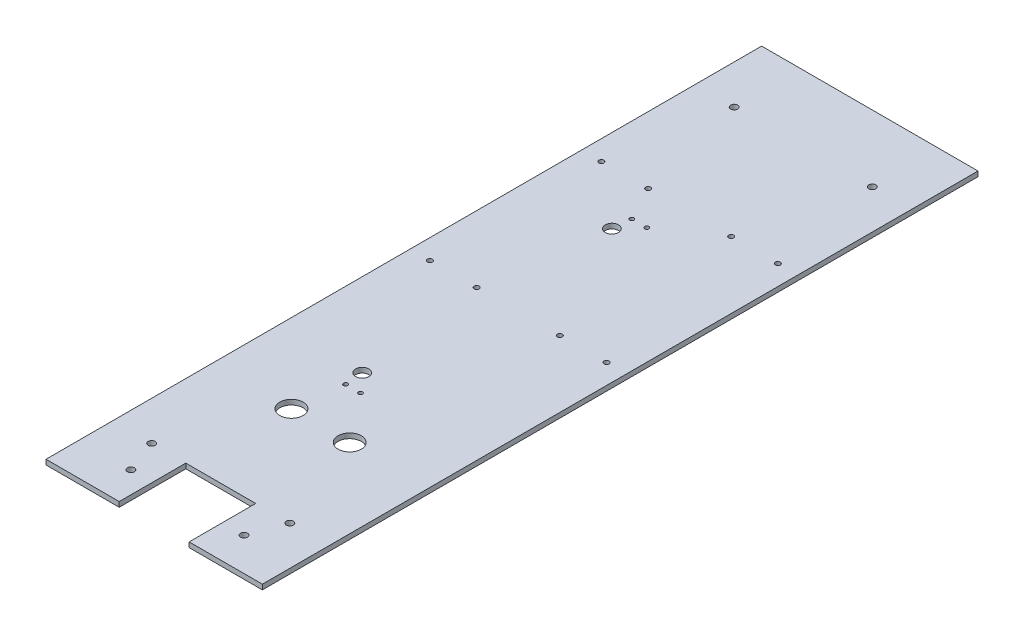
from build123d import *

# Parameters (mm, degrees)
SKETCH1_W           = 130
SKETCH1_H           = 430
BOSS_EXTRUDE1_DEPTH = 3
SKETCH2_W           = 42
SKETCH2_H           = 40
CUT_EXTRUDE1_DEPTH  = 10
SKETCH3_R           = 1.5
SKETCH3_R_2         = 2.1
CUT_EXTRUDE2_DEPTH  = 10
SKETCH4_R           = 7
CUT_EXTRUDE3_DEPTH  = 10
SKETCH5_R           = 4
SKETCH5_R_2         = 1.25
CUT_EXTRUDE4_DEPTH  = 10


with BuildPart() as part:
    # Sketch1 → Boss-Extrude1 (new body)
    with BuildSketch(Plane(origin=(0, 0, 0), x_dir=(1, 0, 0), z_dir=(0, 1, 0))):
        Rectangle(SKETCH1_W, SKETCH1_H)
    extrude(amount=BOSS_EXTRUDE1_DEPTH)

    # Sketch2 → Cut-Extrude1 (cut)
    with BuildSketch(Plane(origin=(0, 3, 0), x_dir=(1, 0, 0), z_dir=(0, 1, 0))):
        with Locations((0, -195)):
            Rectangle(SKETCH2_W, SKETCH2_H)
    extrude(amount=-CUT_EXTRUDE1_DEPTH, mode=Mode.SUBTRACT)

    # Sketch3 → Cut-Extrude2 (cut)
    with BuildSketch(Plane.XZ):
        with Locations(Location((-53.05, -3.75, 0), (0, 0, 270))):
            Circle(SKETCH3_R)
        with Locations(Location((-24.95, -3.75, 0), (0, 0, 270))):
            Circle(SKETCH3_R)
        with Locations(Location((-53.05, -106.75, 0), (0, 0, 270))):
            Circle(SKETCH3_R)
        with Locations(Location((-24.95, -106.75, 0), (0, 0, 270))):
            Circle(SKETCH3_R)
        with Locations(Location((24.95, -106.75, 0), (0, 0, 90))):
            Circle(SKETCH3_R)
        with Locations(Location((34, 195, 0), (0, 0, 270))):
            Circle(SKETCH3_R_2)
        with Locations(Location((53.05, -106.75, 0), (0, 0, 90))):
            Circle(SKETCH3_R)
        with Locations(Location((24.95, -3.75, 0), (0, 0, 90))):
            Circle(SKETCH3_R)
        with Locations(Location((-34, 195, 0), (0, 0, 270))):
            Circle(SKETCH3_R_2)
        with Locations(Location((53.05, -3.75, 0), (0, 0, 90))):
            Circle(SKETCH3_R)
        with Locations(Location((-41.5, 175, 0), (0, 0, 270))):
            Circle(SKETCH3_R_2)
        with Locations(Location((41.5, 175, 0), (0, 0, 270))):
            Circle(SKETCH3_R_2)
        with Locations(Location((41.5, -175, 0), (0, 0, 270))):
            Circle(SKETCH3_R_2)
        with Locations(Location((-41.5, -175, 0), (0, 0, 270))):
            Circle(SKETCH3_R_2)
    extrude(amount=-CUT_EXTRUDE2_DEPTH, mode=Mode.SUBTRACT)

    # Sketch4 → Cut-Extrude3 (cut)
    with BuildSketch(Plane.XZ):
        with Locations(Location((-17.5, 115, 0), (0, 0, 270))):
            Circle(SKETCH4_R)
        with Locations(Location((17.5, 115, 0), (0, 0, 270))):
            Circle(SKETCH4_R)
    extrude(amount=-CUT_EXTRUDE3_DEPTH, mode=Mode.SUBTRACT)

    # Sketch5 → Cut-Extrude4 (cut)
    with BuildSketch(Plane.XZ):
        with Locations(Location((-15, -75, 0), (0, 0, 270))):
            Circle(SKETCH5_R)
        with Locations(Location((-14, -86, 0), (0, 0, 270))):
            Circle(SKETCH5_R_2)
        with Locations(Location((-5, -86, 0), (0, 0, 270))):
            Circle(SKETCH5_R_2)
        with Locations(Location((-15, 75, 0), (0, 0, 90))):
            Circle(SKETCH5_R)
        with Locations(Location((-14, 86, 0), (0, 0, 90))):
            Circle(SKETCH5_R_2)
        with Locations(Location((-5, 86, 0), (0, 0, 90))):
            Circle(SKETCH5_R_2)
    extrude(amount=-CUT_EXTRUDE4_DEPTH, mode=Mode.SUBTRACT)


solid = part.part
